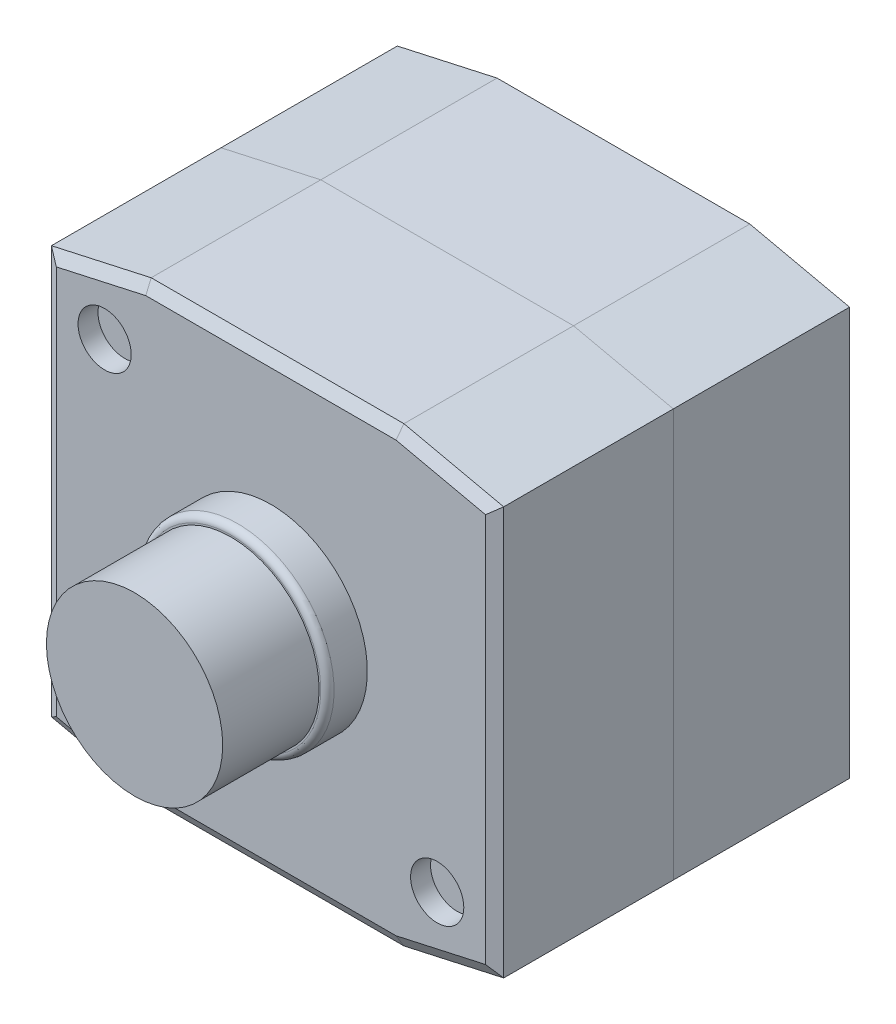
from build123d import *

# Parameters (mm, degrees)
SKETCH4_R                    = 14.5
BOSS_EXTRUDE3_DEPTH          = 6
BOSS_EXTRUDE4_DEPTH          = 26.5
F_8_0_8_DIAMETER_HOLE1_D     = 8
F_8_0_8_DIAMETER_HOLE1_DEPTH = 3
CHAMFER1_SIZE                = 1.732050808
CHAMFER1_SIZE2               = 1
CHAMFER2_SIZE                = 1
CHAMFER2_SIZE2               = 1.732050808
FILLET3_R                    = 1
BOSS_EXTRUDE7_DEPTH          = 26.5
SKETCH41_R                   = 13.25
BOSS_EXTRUDE8_DEPTH          = 14.5


with BuildPart() as part:
    # Sketch4 → Boss-Extrude3 (new body)
    with BuildSketch(Plane.XY.offset(59)):
        with Locations(Location((0, 34, 0), (0, 0, 180))):
            Circle(SKETCH4_R)
    extrude(amount=-BOSS_EXTRUDE3_DEPTH)

    # Sketch5 → Boss-Extrude4 (add)
    with BuildSketch(Plane.XY.offset(53)):
        Polygon((-19, 0), (19, 0), (34, 3.32541994), (34, 64.67458006), (19, 68), (-19, 68), (-34, 64.67458006), (-34, 3.32541994), align=None)
    extrude(amount=-BOSS_EXTRUDE4_DEPTH)

    # Ø8.0 (8) Diameter Hole1
    with Locations(Plane.XY.offset(53)):
        with Locations((-25, 57.5), (25, 10.5)):
            Hole(F_8_0_8_DIAMETER_HOLE1_D / 2, depth=F_8_0_8_DIAMETER_HOLE1_DEPTH)

    # Chamfer1
    chamfer1_edges = [part.edges().sort_by_distance(p)[0] for p in [
        (26.5, 66.33729003, 53),
        (0, 68, 53),
        (-26.5, 66.33729003, 53),
        (-34, 34, 53),
        (-26.5, 1.66270997, 53),
        (0, 0, 53),
        (26.5, 1.66270997, 53),
    ]]
    chamfer1_side = [part.faces().sort_by_distance(p)[0] for p in [
        (0, 0.961665222, 53),
    ]]
    chamfer(chamfer1_edges, length=CHAMFER1_SIZE, length2=CHAMFER1_SIZE2, reference=chamfer1_side[0])

    # Chamfer2
    chamfer2_edges = [part.edges().sort_by_distance(p)[0] for p in [
        (34, 34, 53),
    ]]
    chamfer2_side = [part.faces().sort_by_distance(p)[0] for p in [
        (34, 34, 39.735889277),
    ]]
    chamfer(chamfer2_edges, length=CHAMFER2_SIZE, length2=CHAMFER2_SIZE2, reference=chamfer2_side[0])

    # Fillet3
    fillet3_edges = [part.edges().sort_by_distance(p)[0] for p in [
        (14.5, 34, 59),
    ]]
    fillet(fillet3_edges, radius=FILLET3_R)

    # Sketch41 → Boss-Extrude8 (add)
    with BuildSketch(Plane.XY.offset(59)):
        with Locations(Location((0, 34, 0), (0, 0, 180))):
            Circle(SKETCH41_R)
    extrude(amount=BOSS_EXTRUDE8_DEPTH)


with BuildPart() as body_2:
    # Sketch40 → Boss-Extrude7 (new body)
    with BuildSketch(Plane(origin=(0, 0, 26.5), x_dir=(-1, 0, 0), z_dir=(0, 0, -1))):
        Polygon((34, 3.32541994), (34, 64.67458006), (19, 68), (-19, 68), (-34, 64.67458006), (-34, 3.32541994), (-19, 0), (19, 0), align=None)
    extrude(amount=BOSS_EXTRUDE7_DEPTH)


solid = Compound([part.part, body_2.part])
